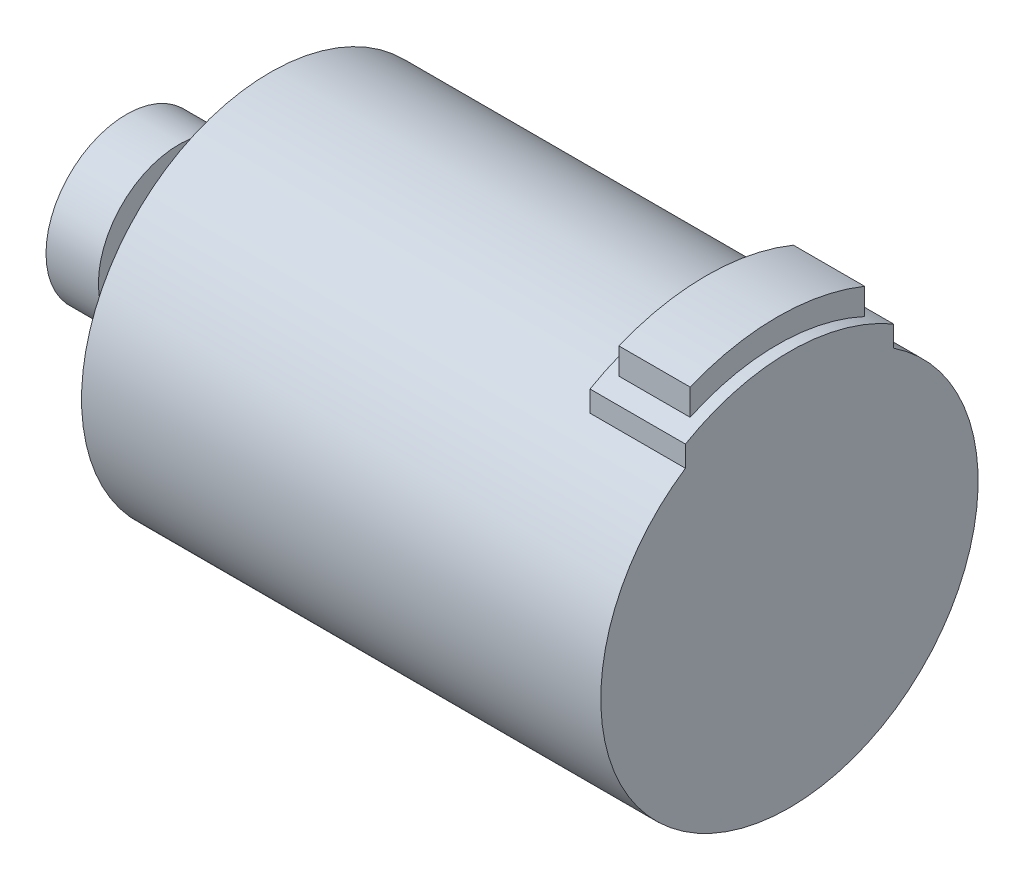
from build123d import *

# Parameters (mm, degrees)
SCHIZZO1_R                    = 18
ESTRUSIONE_ESTRUSIONE1_DEPTH  = 49.54
SCHIZZO2_R                    = 2.495
ESTRUSIONE_ESTRUSIONE2_DEPTH  = 2.5
SCHIZZO3_R                    = 1.575
ESTRUSIONE_ESTRUSIONE3_DEPTH  = 12.7
SCHIZZO4_R                    = 7.67
ESTRUSIONE_ESTRUSIONE4_DEPTH  = 5
SCHIZZO5_R                    = 4.01
ESTRUSIONE_ESTRUSIONE5_DEPTH  = 9.03
FORO_FILETTATO_M3X0_5_1_D     = 2.5
FORO_FILETTATO_M3X0_5_1_DEPTH = 9
FORO_FILETTATO_M3X0_5_1_TIP   = 0.751075774
ESTRUSIONE_ESTRUSIONE6_START  = -9.1
ESTRUSIONE_ESTRUSIONE6_DEPTH  = 9.1
ESTRUSIONE_ESTRUSIONE7_START  = -4.55
ESTRUSIONE_ESTRUSIONE7_DEPTH  = 3.4


with BuildPart() as part:
    # Schizzo1 → Estrusione-Estrusione1 (new body)
    with BuildSketch(Plane(origin=(0, 0, 0), x_dir=(0, 0, -1), z_dir=(1, 0, 0))):
        Circle(SCHIZZO1_R)
    extrude(amount=ESTRUSIONE_ESTRUSIONE1_DEPTH)

    # Schizzo2 → Estrusione-Estrusione2 (add)
    with BuildSketch(Plane.ZY):
        with Locations(Location((0, 0, 0), (0, 0, 180))):
            Circle(SCHIZZO2_R)
    extrude(amount=ESTRUSIONE_ESTRUSIONE2_DEPTH)

    # Schizzo3 → Estrusione-Estrusione3 (add)
    with BuildSketch(Plane.ZY.offset(2.5)):
        Circle(SCHIZZO3_R)
    extrude(amount=ESTRUSIONE_ESTRUSIONE3_DEPTH)

    # Schizzo4 → Estrusione-Estrusione4 (add)
    with BuildSketch(Plane.ZY.offset(13.72)):
        Circle(SCHIZZO4_R)
    extrude(amount=-ESTRUSIONE_ESTRUSIONE4_DEPTH)

    # Schizzo5 → Estrusione-Estrusione5 (add)
    with BuildSketch(Plane.ZY.offset(13.72)):
        Circle(SCHIZZO5_R)
    extrude(amount=-ESTRUSIONE_ESTRUSIONE5_DEPTH)

    # Foro filettato M3x0.5-1
    with Locations(Plane.ZY):
        with Locations((12.5, 0), (6.25, -10.825317547), (-6.25, -10.825317547), (-12.5, 0), (-6.25, 10.825317547), (6.25, 10.825317547)):
            Hole(FORO_FILETTATO_M3X0_5_1_D / 2, depth=FORO_FILETTATO_M3X0_5_1_DEPTH)
            with Locations((0, 0, -(FORO_FILETTATO_M3X0_5_1_DEPTH + FORO_FILETTATO_M3X0_5_1_TIP / 2))):  # 118° drill point
                Cone(0, FORO_FILETTATO_M3X0_5_1_D / 2, FORO_FILETTATO_M3X0_5_1_TIP, mode=Mode.SUBTRACT)

    # Schizzo10 → Estrusione-Estrusione6 (add)
    with BuildSketch(Plane(origin=(49.54, 0, 0), x_dir=(0, 0, -1), z_dir=(1, 0, 0)).offset(ESTRUSIONE_ESTRUSIONE6_START)):
        with BuildLine():
            ThreePointArc((-9.925, 15.016470124), (-5.181869246, 17.237988024), (0, 18))
            Line((0, 18), (0, 19.69938782))
            ThreePointArc((0, 19.69938782), (-4.26355498, 19.232472005), (-8.325, 17.85385828))
            ThreePointArc((-8.325, 17.85385828), (-9.134600688, 17.453508265), (-9.925, 17.016470124))
            Line((-9.925, 17.016470124), (-9.925, 15.016470124))
        make_face()
        with BuildLine():
            Line((0, 19.69938782), (0, 18))
            ThreePointArc((0, 18), (5.181869246, 17.237988024), (9.925, 15.016470124))
            Line((9.925, 15.016470124), (9.925, 17.016470124))
            ThreePointArc((9.925, 17.016470124), (9.134600688, 17.453508265), (8.325, 17.85385828))
            ThreePointArc((8.325, 17.85385828), (4.26355498, 19.232472005), (0, 19.69938782))
        make_face()
    extrude(amount=ESTRUSIONE_ESTRUSIONE6_DEPTH)

    # Schizzo10<4> → Estrusione-Estrusione7 (add, symmetric)
    with BuildSketch(Plane(origin=(49.54, 0, 0), x_dir=(0, 0, -1), z_dir=(1, 0, 0)).offset(ESTRUSIONE_ESTRUSIONE7_START)):
        with BuildLine():
            ThreePointArc((-8.325, 17.85385828), (-4.26355498, 19.232472005), (0, 19.69938782))
            Line((0, 19.69938782), (0, 21.990570068))
            ThreePointArc((0, 21.990570068), (-4.24218253, 21.577512815), (-8.325, 20.35385828))
            Line((-8.325, 20.35385828), (-8.325, 17.85385828))
        make_face()
        with BuildLine():
            Line((0, 21.990570068), (0, 19.69938782))
            ThreePointArc((0, 19.69938782), (4.26355498, 19.232472005), (8.325, 17.85385828))
            Line((8.325, 17.85385828), (8.325, 20.35385828))
            ThreePointArc((8.325, 20.35385828), (4.24218253, 21.577512815), (0, 21.990570068))
        make_face()
    extrude(amount=ESTRUSIONE_ESTRUSIONE7_DEPTH, both=True)


solid = part.part
